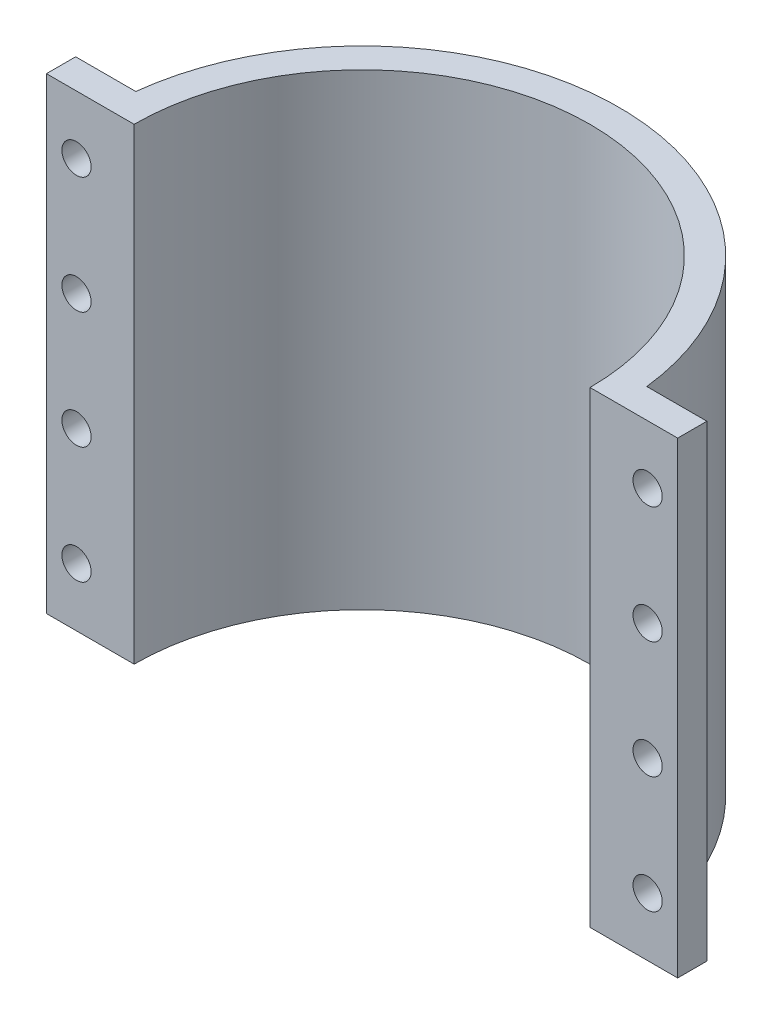
from build123d import *

# Parameters (mm, degrees)
BOSS_EXTRUDE1_DEPTH = 101.6
SKETCH2_R           = 3.175
CUT_EXTRUDE1_DEPTH  = 133.208158977


with BuildPart() as part:
    # Sketch1 → Boss-Extrude1 (new body)
    with BuildSketch(Plane(origin=(0, 0, 0), x_dir=(1, 0, 0), z_dir=(0, 1, 0))):
        with BuildLine():
            Line((55.518032206, 6.35), (68.58, 6.35))
            Line((68.58, 6.35), (68.58, 0))
            Line((68.58, 0), (49.53, 0))
            ThreePointArc((49.53, 0), (0, 49.53), (-49.53, 0))
            Line((-49.53, 0), (-68.58, 0))
            Line((-68.58, 0), (-68.58, 6.35))
            Line((-68.58, 6.35), (-55.518032206, 6.35))
            ThreePointArc((-55.518032206, 6.35), (0, 55.88), (55.518032206, 6.35))
        make_face()
    extrude(amount=BOSS_EXTRUDE1_DEPTH)

    # Sketch2 → Cut-Extrude1 (cut, through all)
    with BuildSketch(Plane(origin=(0, 0, -6.35), x_dir=(-1, 0, 0), z_dir=(0, 0, -1))):
        with Locations((62.049016103, 88.9)):
            Circle(SKETCH2_R)
        with Locations((62.049016103, 63.5)):
            Circle(SKETCH2_R)
        with Locations((62.049016103, 38.1)):
            Circle(SKETCH2_R)
        with Locations((62.049016103, 12.7)):
            Circle(SKETCH2_R)
        with Locations(Location((-62.049016103, 12.7, 0), (0, 0, 180))):
            Circle(SKETCH2_R)
        with Locations(Location((-62.049016103, 38.1, 0), (0, 0, 180))):
            Circle(SKETCH2_R)
        with Locations(Location((-62.049016103, 63.5, 0), (0, 0, 180))):
            Circle(SKETCH2_R)
        with Locations(Location((-62.049016103, 88.9, 0), (0, 0, 180))):
            Circle(SKETCH2_R)
    extrude(amount=-CUT_EXTRUDE1_DEPTH, mode=Mode.SUBTRACT)


solid = part.part
